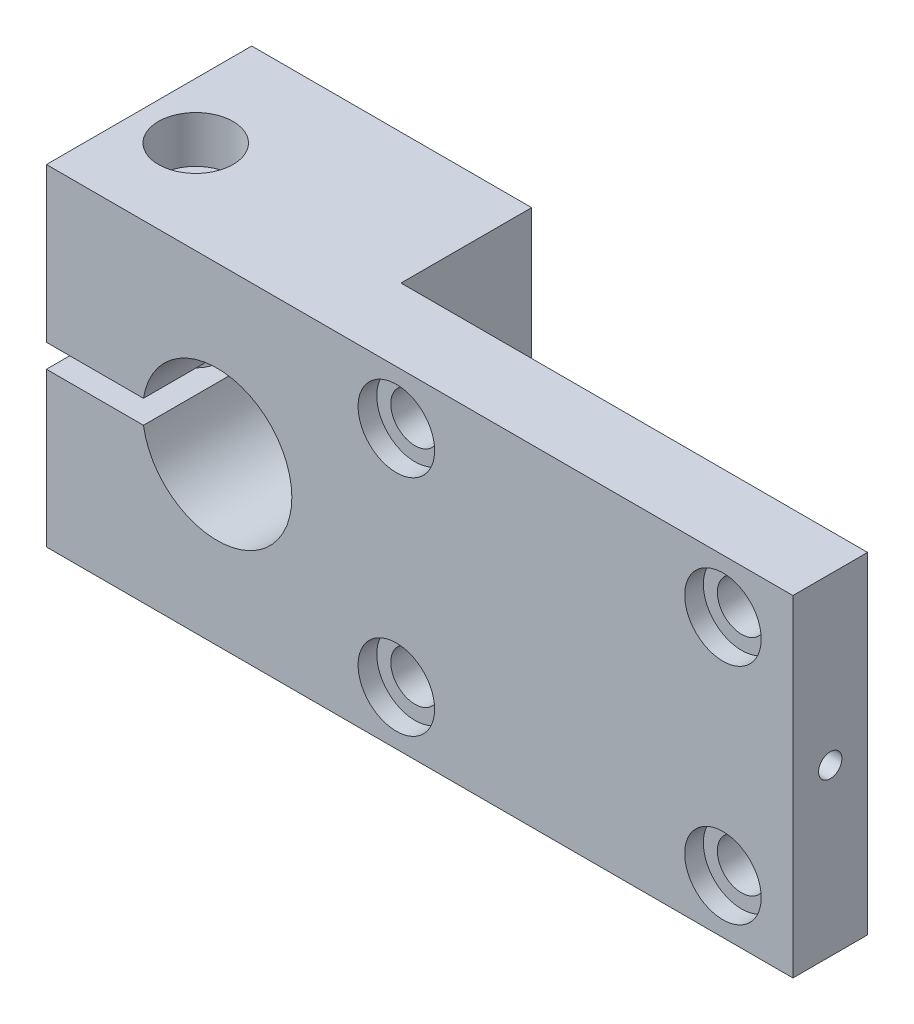
from build123d import *

# Parameters (mm, degrees)
ESQUISSE1_R             = 2.1
BOSS_EXTRU_1_DEPTH      = 22
ESQUISSE2_W             = 52.543778308
ESQUISSE2_H             = 17.447246457
ENL_V_MAT_EXTRU_1_DEPTH = 42
ESQUISSE3_R             = 3.1
ESQUISSE3_R_2           = 3.6
ENL_V_MAT_EXTRU_2_DEPTH = 2
D_GAGEMENT_M51_D        = 5.3
D_GAGEMENT_M51_DEPTH    = 34
D_GAGEMENT_M51_TIP      = 1.59228064
ESQUISSE6_R             = 4
ENL_V_MAT_EXTRU_3_DEPTH = 3
ENL_V_MAT_EXTRU_4_DEPTH = 8
ESQUISSE8_R             = 1.25
ENL_V_MAT_EXTRU_5_DEPTH = 5
BOSS_EXTRU_2_START      = 2
ESQUISSE9_R             = 4
BOSS_EXTRU_2_DEPTH      = 2
BOSS_EXTRU_3_DEPTH      = 2
ESQUISSE11_R            = 2.6
ENL_V_MAT_EXTRU_6_DEPTH = 10
ESQUISSE12_R            = 4.1
ENL_V_MAT_EXTRU_7_DEPTH = 2


with BuildPart() as part:
    # Esquisse1 → Boss.-Extru.1 (new body)
    with BuildSketch(Plane.XY):
        with BuildLine():
            Line((-18.3, 1.25), (-7.901740315, 1.25))
            ThreePointArc((-7.901740315, 1.25), (8, 0), (-7.901740315, -1.25))
            Line((-7.901740315, -1.25), (-18.3, -1.25))
            Line((-18.3, -1.25), (-18.3, -15.75))
            Line((-18.3, -15.75), (61.7, -15.75))
            Line((61.7, -15.75), (61.7, 15.75))
            Line((61.7, 15.75), (-18.3, 15.75))
            Line((-18.3, 15.75), (-18.3, 1.25))
        make_face()
        with Locations((19.2, -12)):
            Circle(ESQUISSE1_R, mode=Mode.SUBTRACT)
        with Locations((54.2, -12)):
            Circle(ESQUISSE1_R, mode=Mode.SUBTRACT)
        with Locations((54.2, 12)):
            Circle(ESQUISSE1_R, mode=Mode.SUBTRACT)
        with Locations((19.2, 12)):
            Circle(ESQUISSE1_R, mode=Mode.SUBTRACT)
    extrude(amount=BOSS_EXTRU_1_DEPTH)

    # Esquisse2 → Enlèv. mat.-Extru.1 (cut)
    with BuildSketch(Plane(origin=(0, 15.75, 0), x_dir=(1, 0, 0), z_dir=(0, 1, 0))):
        with Locations((37.971889154, -5.276376771)):
            Rectangle(ESQUISSE2_W, ESQUISSE2_H)
    extrude(amount=-ENL_V_MAT_EXTRU_1_DEPTH, mode=Mode.SUBTRACT)

    # Esquisse3 → Enlèv. mat.-Extru.2 (cut)
    with BuildSketch(Plane.XY.offset(22)):
        with Locations((19.2, -12)):
            Circle(ESQUISSE3_R)
        with Locations((54.2, -12)):
            Circle(ESQUISSE3_R)
        with Locations((54.2, 12)):
            Circle(ESQUISSE3_R_2)
        with Locations((19.2, 12)):
            Circle(ESQUISSE3_R)
    extrude(amount=-ENL_V_MAT_EXTRU_2_DEPTH, mode=Mode.SUBTRACT)

    # Dégagement M51
    with Locations(Plane(origin=(0, 15.75, 0), x_dir=(1, 0, 0), z_dir=(0, 1, 0))):
        with Locations((-12.3, -12)):
            Hole(D_GAGEMENT_M51_D / 2, depth=D_GAGEMENT_M51_DEPTH)
            with Locations((0, 0, -(D_GAGEMENT_M51_DEPTH + D_GAGEMENT_M51_TIP / 2))):  # 118° drill point
                Cone(0, D_GAGEMENT_M51_D / 2, D_GAGEMENT_M51_TIP, mode=Mode.SUBTRACT)

    # Esquisse6 → Enlèv. mat.-Extru.3 (cut)
    with BuildSketch(Plane(origin=(0, 15.75, 0), x_dir=(1, 0, 0), z_dir=(0, 1, 0))):
        with Locations(Location((-12.3, -12, 0), (0, 0, 180))):
            Circle(ESQUISSE6_R)
    extrude(amount=-ENL_V_MAT_EXTRU_3_DEPTH, mode=Mode.SUBTRACT)

    # Esquisse7 → Enlèv. mat.-Extru.4 (cut)
    with BuildSketch(Plane.XZ.offset(15.75)):
        Polygon((-12.3, 16.618802154), (-16.3, 14.309401077), (-16.3, 9.690598923), (-12.3, 7.381197846), (-8.3, 9.690598923), (-8.3, 14.309401077), align=None)
    extrude(amount=-ENL_V_MAT_EXTRU_4_DEPTH, mode=Mode.SUBTRACT)

    # Esquisse8 → Enlèv. mat.-Extru.5 (cut)
    with BuildSketch(Plane(origin=(61.7, 0, 0), x_dir=(0, 0, -1), z_dir=(1, 0, 0))):
        with Locations(Location((-18, 0, 0), (0, 0, 90))):
            Circle(ESQUISSE8_R)
    extrude(amount=-ENL_V_MAT_EXTRU_5_DEPTH, mode=Mode.SUBTRACT)

    # Esquisse9 → Boss.-Extru.2 (add)
    with BuildSketch(Plane(origin=(0, 15.75, 0), x_dir=(1, 0, 0), z_dir=(0, 1, 0)).offset(BOSS_EXTRU_2_START)):
        Polygon((61.7, -22), (61.7, -14), (11.7, -14), (11.7, 0), (-18.3, 0), (-18.3, -22), align=None)
        with Locations(Location((-12.3, -12, 0), (0, 0, 180))):
            Circle(ESQUISSE9_R, mode=Mode.SUBTRACT)
    extrude(amount=-BOSS_EXTRU_2_DEPTH)

    # Esquisse10 → Boss.-Extru.3 (add)
    with BuildSketch(Plane.XZ.offset(15.75)):
        Polygon((11.7, 0), (11.7, 14), (61.7, 14), (61.7, 22), (-18.3, 22), (-18.3, 0), align=None)
        Polygon((-12.3, 16.618802154), (-16.3, 14.309401077), (-16.3, 9.690598923), (-12.3, 7.381197846), (-8.3, 9.690598923), (-8.3, 14.309401077), align=None, mode=Mode.SUBTRACT)
    extrude(amount=BOSS_EXTRU_3_DEPTH)

    # Esquisse11 → Enlèv. mat.-Extru.6 (cut)
    with BuildSketch(Plane.XY.offset(20)):
        with Locations((54.2, 12)):
            Circle(ESQUISSE11_R)
        with Locations((54.2, -12)):
            Circle(ESQUISSE11_R)
        with Locations((19.2, -12)):
            Circle(ESQUISSE11_R)
        with Locations((19.2, 12)):
            Circle(ESQUISSE11_R)
    extrude(amount=-ENL_V_MAT_EXTRU_6_DEPTH, mode=Mode.SUBTRACT)

    # Esquisse12 → Enlèv. mat.-Extru.7 (cut)
    with BuildSketch(Plane.XY.offset(22)):
        with Locations((54.2, -12)):
            Circle(ESQUISSE12_R)
        with Locations((19.2, -12)):
            Circle(ESQUISSE12_R)
        with Locations((19.2, 12)):
            Circle(ESQUISSE12_R)
        with Locations((54.2, 12)):
            Circle(ESQUISSE12_R)
    extrude(amount=-ENL_V_MAT_EXTRU_7_DEPTH, mode=Mode.SUBTRACT)


solid = part.part
